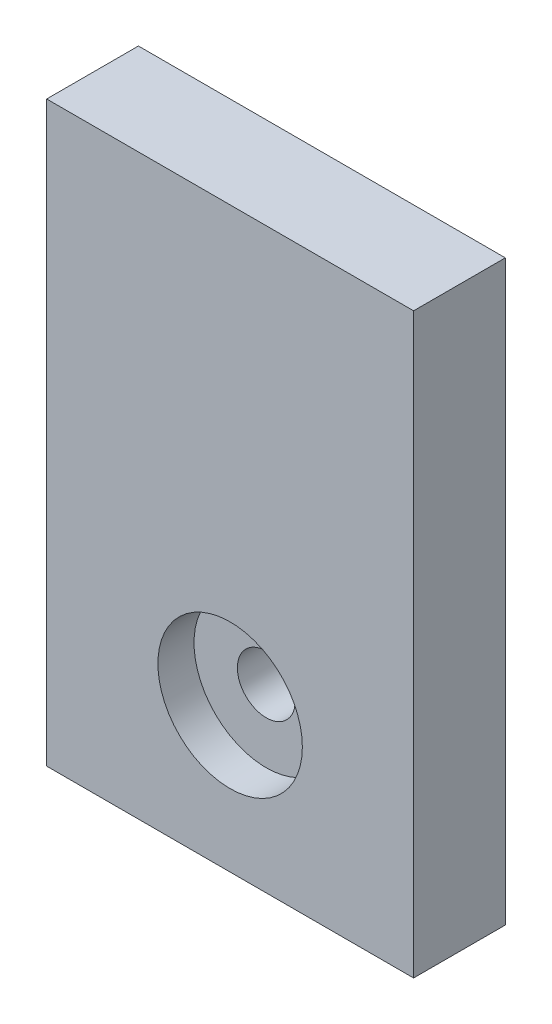
from build123d import *

# Parameters (mm, degrees)
CROQUIS1_W              = 50.8
CROQUIS1_H              = 80
CROQUIS1_R              = 4
SALIENTE_EXTRUIR1_DEPTH = 12.7
CROQUIS2_R              = 10
CORTAR_EXTRUIR1_DEPTH   = 5


with BuildPart() as part:
    # Croquis1 → Saliente-Extruir1 (new body)
    with BuildSketch(Plane.XY):
        Rectangle(CROQUIS1_W, CROQUIS1_H)
        with Locations((0, -20)):
            Circle(CROQUIS1_R, mode=Mode.SUBTRACT)
    extrude(amount=SALIENTE_EXTRUIR1_DEPTH)

    # Croquis2 → Cortar-Extruir1 (cut)
    with BuildSketch(Plane.XY.offset(12.7)):
        with Locations((0, -20)):
            Circle(CROQUIS2_R)
    extrude(amount=-CORTAR_EXTRUIR1_DEPTH, mode=Mode.SUBTRACT)


solid = part.part
